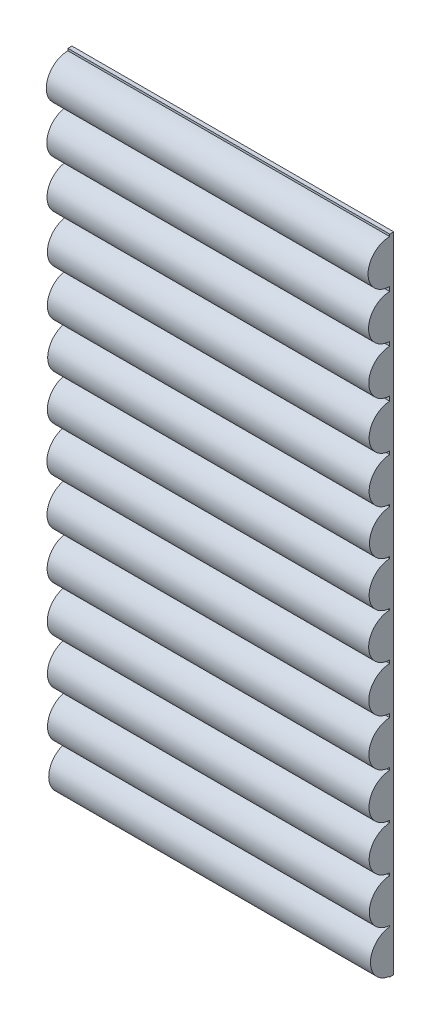
from build123d import *

# Parameters (mm, degrees)
SKETCH_1_W      = 2.08
SKETCH_1_H      = 4.16
EXTRUDE_1_DEPTH = 0.026
EXTRUDE_2_DEPTH = 2.08


with BuildPart() as part:
    # 草图1 → 凸台-拉伸1 (new body)
    with BuildSketch(Plane.XY):
        with Locations((1.04, 2.08)):
            Rectangle(SKETCH_1_W, SKETCH_1_H)
    extrude(amount=EXTRUDE_1_DEPTH)

    # 草图2 → 凸台-拉伸2 (add)
    with BuildSketch(Plane.ZY):
        with BuildLine():
            Line((0.026, 4.146203623), (0.026, 3.866891673))
            ThreePointArc((0.026, 3.866891673), (0.165655975, 4.006547648), (0.026, 4.146203623))
        make_face()
        with BuildLine():
            Line((0.022993244, 3.838762788), (0.022993244, 3.559450839))
            ThreePointArc((0.022993244, 3.559450839), (0.162649218, 3.699106813), (0.022993244, 3.838762788))
        make_face()
        with BuildLine():
            Line((0.021489866, 3.532825332), (0.021489866, 3.253513382))
            ThreePointArc((0.021489866, 3.253513382), (0.16114584, 3.393169357), (0.021489866, 3.532825332))
        make_face()
        with BuildLine():
            Line((0.019234798, 3.224632808), (0.019234798, 2.945320858))
            ThreePointArc((0.019234798, 2.945320858), (0.158890773, 3.084976833), (0.019234798, 3.224632808))
        make_face()
        with BuildLine():
            Line((0.019234798, 2.925460553), (0.019234798, 2.646148603))
            ThreePointArc((0.019234798, 2.646148603), (0.158890773, 2.785804578), (0.019234798, 2.925460553))
        make_face()
        with BuildLine():
            Line((0.016979731, 2.633805189), (0.016979731, 2.354493239))
            ThreePointArc((0.016979731, 2.354493239), (0.156635706, 2.494149214), (0.016979731, 2.633805189))
        make_face()
        with BuildLine():
            Line((0.019234798, 2.343653203), (0.019234798, 2.064341253))
            ThreePointArc((0.019234798, 2.064341253), (0.158890773, 2.203997228), (0.019234798, 2.343653203))
        make_face()
        with BuildLine():
            Line((0.022241555, 2.055004595), (0.022241555, 1.775692646))
            ThreePointArc((0.022241555, 1.775692646), (0.161897529, 1.915348621), (0.022241555, 2.055004595))
        make_face()
        with BuildLine():
            Line((0.021489866, 1.755832341), (0.021489866, 1.476520391))
            ThreePointArc((0.021489866, 1.476520391), (0.16114584, 1.616176366), (0.021489866, 1.755832341))
        make_face()
        with BuildLine():
            Line((0.020738176, 1.45290164), (0.020738176, 1.173589691))
            ThreePointArc((0.020738176, 1.173589691), (0.160394151, 1.313245665), (0.020738176, 1.45290164))
        make_face()
        with BuildLine():
            Line((0.020114274, 1.157796023), (0.020114274, 0.878484074))
            ThreePointArc((0.020114274, 0.878484074), (0.159770249, 1.018140049), (0.020114274, 1.157796023))
        make_face()
        with BuildLine():
            Line((0.018905087, 0.863937722), (0.018905087, 0.584625772))
            ThreePointArc((0.018905087, 0.584625772), (0.158561062, 0.724281747), (0.018905087, 0.863937722))
        make_face()
        with BuildLine():
            Line((0.018290589, 0.568669036), (0.018290589, 0.289357086))
            ThreePointArc((0.018290589, 0.289357086), (0.157946563, 0.429013061), (0.018290589, 0.568669036))
        make_face()
        with BuildLine():
            Line((0.010391034, 0.283278205), (0.010391034, 0.003966255))
            ThreePointArc((0.010391034, 0.003966255), (0.150047009, 0.14362223), (0.010391034, 0.283278205))
        make_face()
    extrude(amount=-EXTRUDE_2_DEPTH)


solid = part.part
